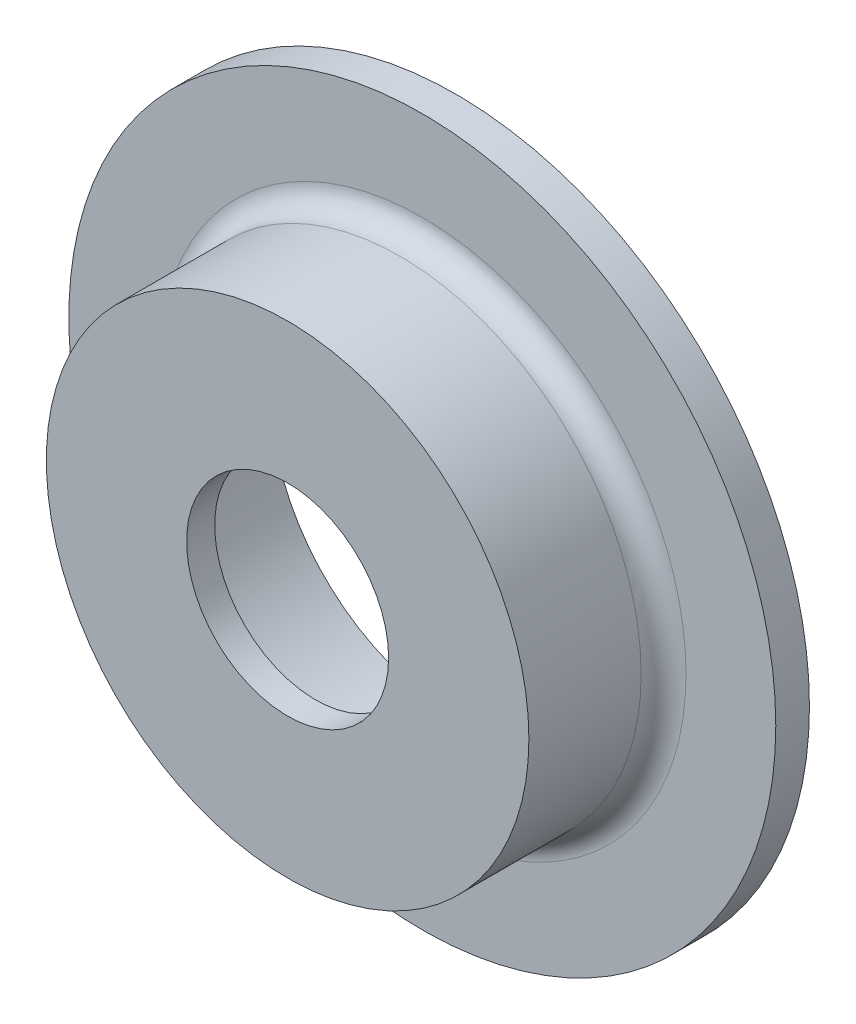
from build123d import *

# Parameters (mm, degrees)
SKETCH1_R           = 12.6
BOSS_EXTRUDE1_DEPTH = 1.2
SKETCH1_3_R         = 8.6
SKETCH1_3_R_2       = 3.6
BOSS_EXTRUDE2_DEPTH = 6
SKETCH1_4_R         = 6.6
SKETCH1_4_R_2       = 3.6
CUT_EXTRUDE1_DEPTH  = 5
FILLET1_R           = 0.8
FILLET2_R           = 0.8


with BuildPart() as part:
    # Sketch1 → Boss-Extrude1 (new body)
    with BuildSketch(Plane.XY):
        Circle(SKETCH1_R)
    extrude(amount=BOSS_EXTRUDE1_DEPTH)

    # Sketch1<3> → Boss-Extrude2 (add)
    with BuildSketch(Plane.XY):
        Circle(SKETCH1_3_R)
        Circle(SKETCH1_3_R_2, mode=Mode.SUBTRACT)
    extrude(amount=BOSS_EXTRUDE2_DEPTH)

    # Sketch1<4> → Cut-Extrude1 (cut)
    with BuildSketch(Plane.XY):
        Circle(SKETCH1_4_R)
        Circle(SKETCH1_4_R_2, mode=Mode.SUBTRACT)
    extrude(amount=CUT_EXTRUDE1_DEPTH, mode=Mode.SUBTRACT)


with BuildPart() as cut_extrude1_kept_piece:
    # of the separate pieces the step leaves, the one the design keeps (cut_extrude1_pieces_kept)
    add(part.part.solids().sort_by_distance((12.6, 0, 0))[0])

    # Fillet1
    fillet1_edges = [cut_extrude1_kept_piece.edges().sort_by_distance(p)[0] for p in [
        (-6.6, 0, 5),
    ]]
    fillet(fillet1_edges, radius=FILLET1_R)

    # Fillet2
    fillet2_edges = [cut_extrude1_kept_piece.edges().sort_by_distance(p)[0] for p in [
        (-8.6, 0, 1.2),
    ]]
    fillet(fillet2_edges, radius=FILLET2_R)


solid = cut_extrude1_kept_piece.part
